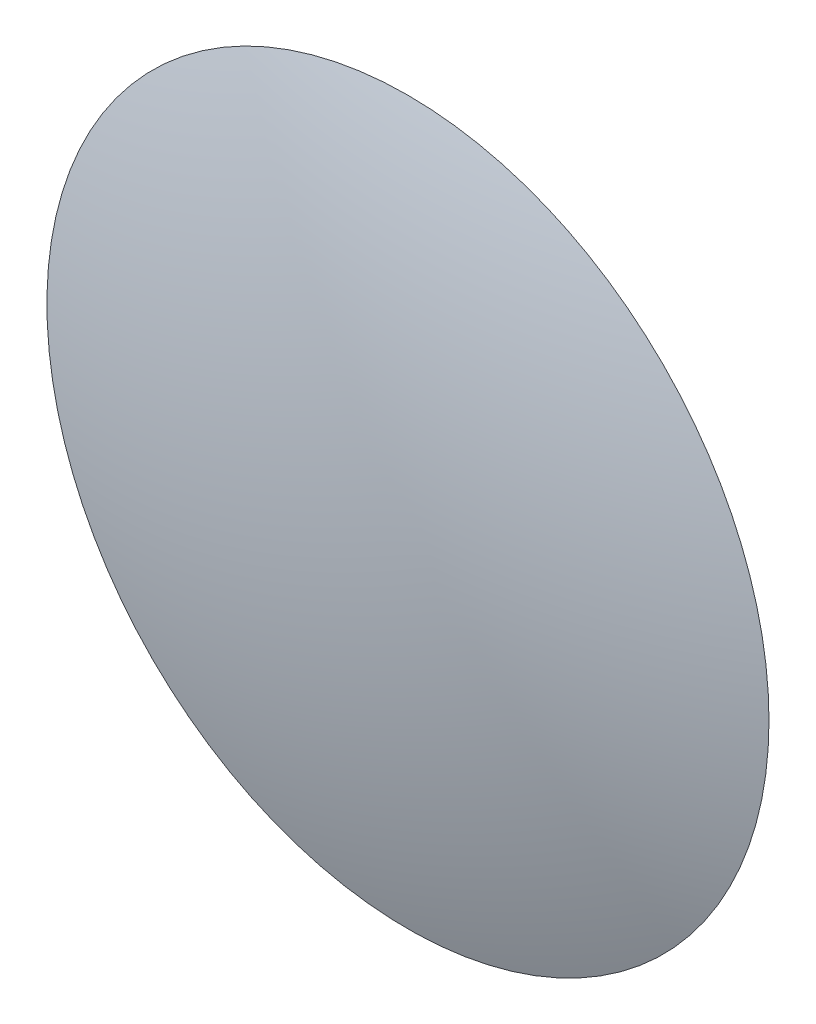
from build123d import *

# Parameters (mm, degrees)
SCALE1_SCALE = 0.75


with BuildPart() as part:
    # Sketch1 → Revolve1 (revolve)
    with BuildSketch(Plane(origin=(0, 0, 0), x_dir=(0, 0, -1), z_dir=(1, 0, 0))):
        with BuildLine():
            Line((0, 0), (0, 22.5))
            ThreePointArc((0, 22.5), (2.640052345, 11.387396334), (3.527205849, 0))
            Line((3.527205849, 0), (0, 0))
        make_face()
    revolve1 = revolve(axis=Axis((0, 0, 34.553258587), (0, 0, -1)))

    # Mirror1: Revolve1 across plane
    add(revolve1.mirror(Plane.XY))


with BuildPart() as part_1:
    # Scale1: scaled about (0, 0, 0)
    add(part.part.scale(SCALE1_SCALE))


solid = part_1.part
